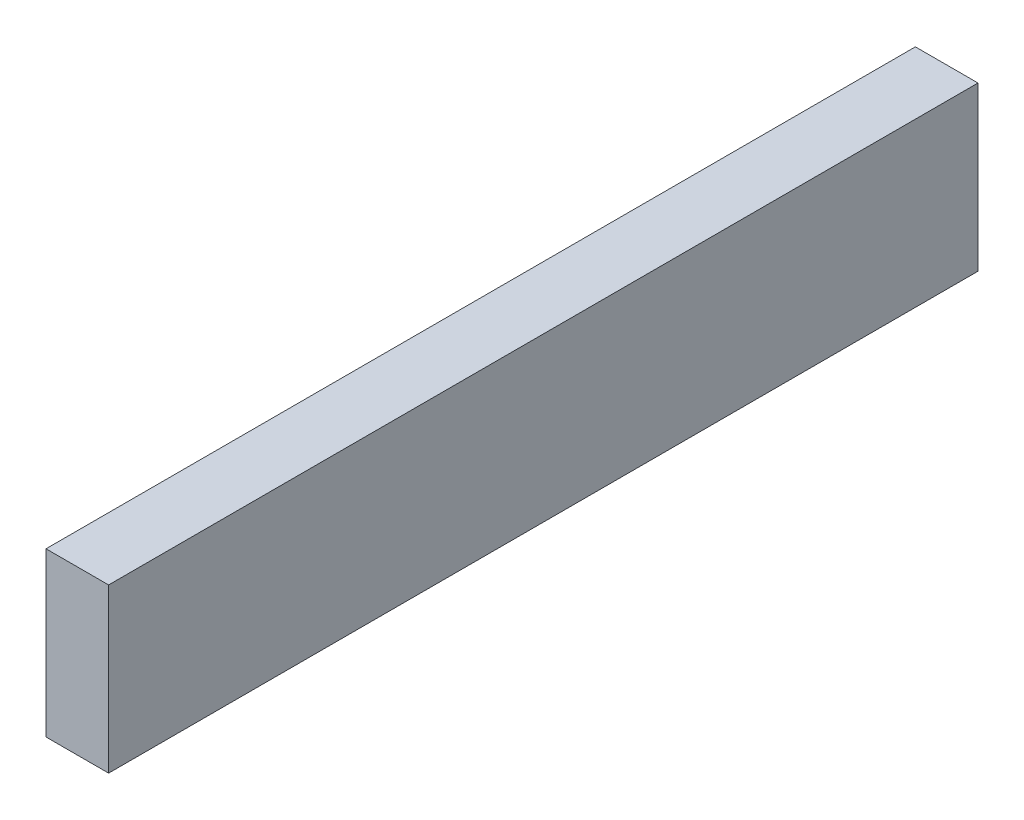
from build123d import *

# Parameters (mm, degrees)
SKETCH1_W           = 14.636392162
SKETCH1_H           = 38.1
BOSS_EXTRUDE1_DEPTH = 203.2


with BuildPart() as part:
    # Sketch1 → Boss-Extrude1 (new body)
    with BuildSketch(Plane.XY):
        Rectangle(SKETCH1_W, SKETCH1_H)
    extrude(amount=BOSS_EXTRUDE1_DEPTH)


solid = part.part
